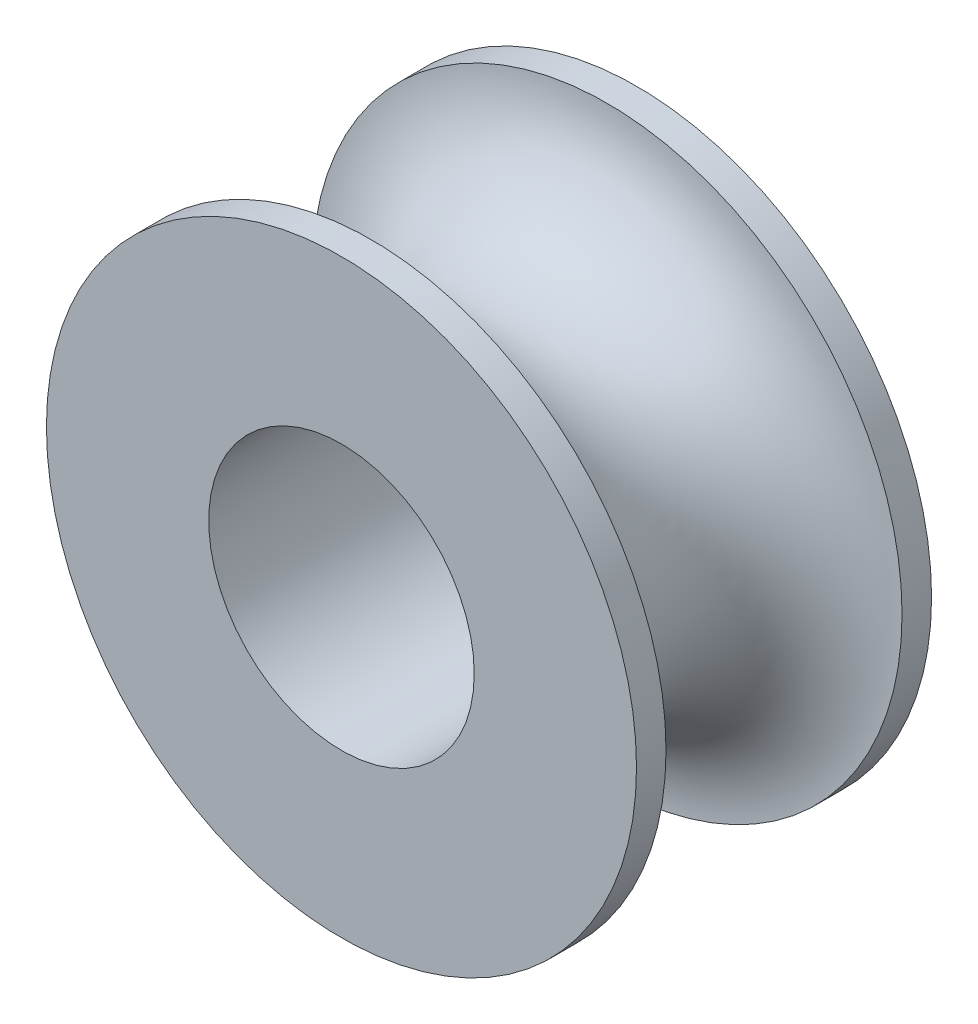
from build123d import *

# Parameters (mm, degrees)
CUT_EXTRUDE_1_DEPTH      = 8.5
CUT_EXTRUDE_1_DEPTH_BACK = 8.5
SKETCH_2_R               = 2.25


with BuildPart() as part:
    # 草图1 → 旋转5 (revolve)
    with BuildSketch(Plane(origin=(0, 0, 0), x_dir=(1, 0, 0), z_dir=(0, 1, 0)), mode=Mode.PRIVATE) as revolve_5_sk:
        with BuildLine():
            Line((0, -2.5), (5, -2.5))
            Line((5, -2.5), (5, -2))
            ThreePointArc((5, -2), (3, 0), (5, 2))
            Line((5, 2), (5, 2.5))
            Line((5, 2.5), (0, 2.5))
            Line((0, 2.5), (0, -2.5))
        make_face()
    revolve(revolve_5_sk.sketch.rotate(Axis((0, 0, -2.75), (0, 0, 1)), 180), axis=Axis((0, 0, -2.75), (0, 0, 1)))

    # 草图2 → 切除-拉伸1 (cut, two sides: drawn at the far end of the back side and taken through both)
    with BuildSketch(Plane.XY.offset(-CUT_EXTRUDE_1_DEPTH_BACK)):
        Circle(SKETCH_2_R)
    extrude(amount=CUT_EXTRUDE_1_DEPTH + CUT_EXTRUDE_1_DEPTH_BACK, mode=Mode.SUBTRACT)


solid = part.part
